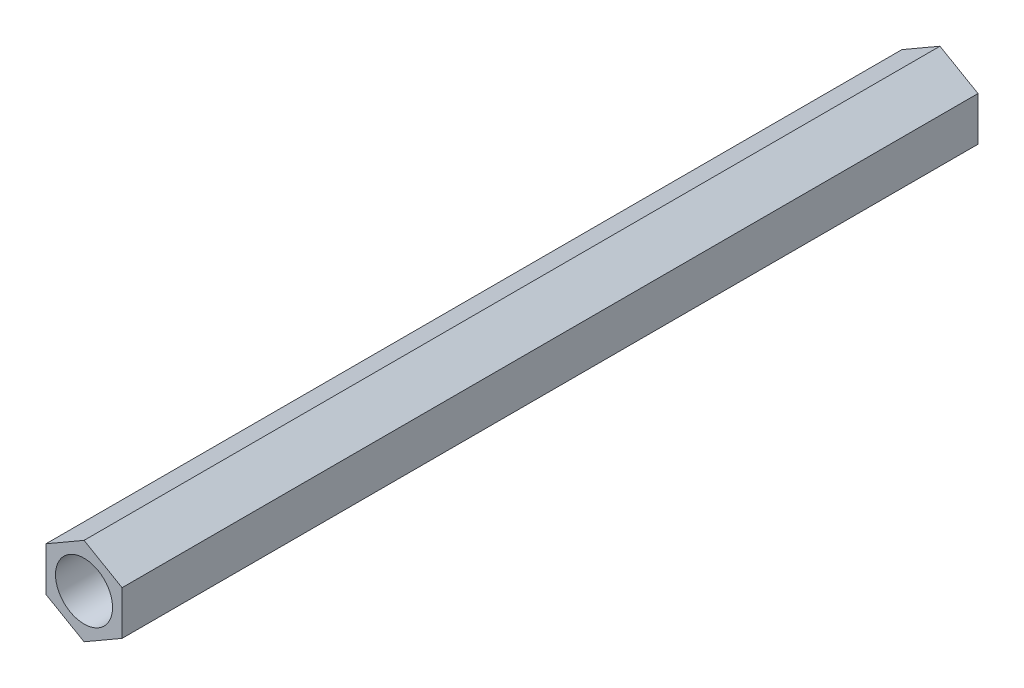
from build123d import *

# Parameters (mm, degrees)
SKETCH_1_R      = 4
SKETCH_1_R_2    = 3
EXTRUDE_1_DEPTH = 90
EXTRUDE_START   = -90
SKETCH_2_R      = 3
EXTRUDE_2_DEPTH = 90


with BuildPart() as part:
    # 草图1 → 凸台-拉伸1 (new body)
    with BuildSketch(Plane.XY):
        with Locations(Location((0, 0, 0), (0, 0, 180))):
            Circle(SKETCH_1_R)
        with Locations(Location((0, 0, 0), (0, 0, 180))):
            Circle(SKETCH_1_R_2, mode=Mode.SUBTRACT)
    extrude(amount=EXTRUDE_1_DEPTH)

    # 草图2 → 凸台-拉伸2 (add)
    with BuildSketch(Plane.XY.offset(90).offset(EXTRUDE_START)):
        Polygon((4, 2.309401077), (0, 4.618802154), (-4, 2.309401077), (-4, -2.309401077), (0, -4.618802154), (4, -2.309401077), align=None)
        with Locations(Location((0, 0, 0), (0, 0, 180))):
            Circle(SKETCH_2_R, mode=Mode.SUBTRACT)
    extrude(amount=EXTRUDE_2_DEPTH)


solid = part.part
